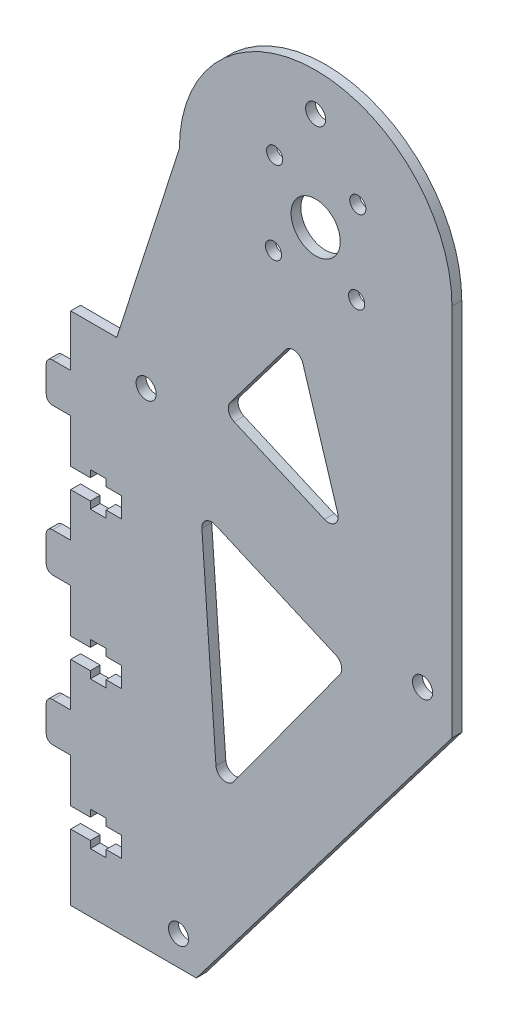
from build123d import *

# Parameters (mm, degrees)
SKETCH_1_R      = 5.0225
SKETCH_1_R_2    = 2.05
SKETCH_1_R_3    = 1.649999998
EXTRUDE_1_DEPTH = 2
FILLET_1_R      = 2
FILLET_2_R      = 1.3


with BuildPart() as part:
    # 草图1 → 凸台-拉伸1 (new body)
    with BuildSketch(Plane.XY):
        with BuildLine():
            Line((298.545628784, -83.894391363), (298.545628784, -92.841778663))
            Line((298.545628784, -92.841778663), (302.545628784, -92.841778663))
            Line((302.545628784, -92.841778663), (302.545628784, -91.391778663))
            Line((302.545628784, -91.391778663), (305.745628784, -91.391778663))
            Line((305.745628784, -91.391778663), (305.745628784, -92.841778663))
            Line((305.745628784, -92.841778663), (308.945628784, -92.841778663))
            Line((308.945628784, -92.841778663), (308.945628784, -96.941778663))
            Line((308.945628784, -96.941778663), (305.745628784, -96.941778663))
            Line((305.745628784, -96.941778663), (305.745628784, -98.391778663))
            Line((305.745628784, -98.391778663), (302.545628784, -98.391778663))
            Line((302.545628784, -98.391778663), (302.545628784, -96.941778663))
            Line((302.545628784, -96.941778663), (298.545628784, -96.941778663))
            Line((298.545628784, -96.941778663), (298.545628784, -105.894391358))
            Line((298.545628784, -105.894391358), (293.545628784, -105.894391358))
            Line((293.545628784, -105.894391358), (293.545628784, -113.894391358))
            Line((293.545628784, -113.894391358), (298.545628784, -113.894391358))
            Line((298.545628784, -113.894391358), (298.545628784, -122.847004054))
            Line((298.545628784, -122.847004054), (302.545628784, -122.847004054))
            Line((302.545628784, -122.847004054), (302.545628784, -121.397004054))
            Line((302.545628784, -121.397004054), (305.745628784, -121.397004054))
            Line((305.745628784, -121.397004054), (305.745628784, -122.847004054))
            Line((305.745628784, -122.847004054), (308.945628784, -122.847004054))
            Line((308.945628784, -122.847004054), (308.945628784, -126.947004054))
            Line((308.945628784, -126.947004054), (305.745628784, -126.947004054))
            Line((305.745628784, -126.947004054), (305.745628784, -128.397004054))
            Line((305.745628784, -128.397004054), (302.545628784, -128.397004054))
            Line((302.545628784, -128.397004054), (302.545628784, -126.947004054))
            Line((302.545628784, -126.947004054), (298.545628784, -126.947004054))
            Line((298.545628784, -126.947004054), (298.545628784, -140.447004054))
            Line((298.545628784, -140.447004054), (324.188862368, -140.447004054))
            Line((324.188862368, -140.447004054), (376.358604426, -71.946984141))
            Line((376.358604426, -71.946984141), (376.358604426, 4.396201153))
            ThreePointArc((376.358604426, 4.396201153), (348.536987634, 32.217817945), (320.715370843, 4.396201153))
            Line((320.715370843, 4.396201153), (307.936987634, -35.346984141))
            Line((307.936987634, -35.346984141), (298.545628784, -35.346984141))
            Line((298.545628784, -35.346984141), (298.545628784, -45.889165972))
            Line((298.545628784, -45.889165972), (293.545628784, -45.889165972))
            Line((293.545628784, -45.889165972), (293.545628784, -53.889165972))
            Line((293.545628784, -53.889165972), (298.545628784, -53.889165972))
            Line((298.545628784, -53.889165972), (298.545628784, -62.841778668))
            Line((298.545628784, -62.841778668), (302.545628784, -62.841778668))
            Line((302.545628784, -62.841778668), (302.545628784, -61.391778668))
            Line((302.545628784, -61.391778668), (305.745628784, -61.391778668))
            Line((305.745628784, -61.391778668), (305.745628784, -62.841778668))
            Line((305.745628784, -62.841778668), (308.945628784, -62.841778668))
            Line((308.945628784, -62.841778668), (308.945628784, -66.941778668))
            Line((308.945628784, -66.941778668), (305.745628784, -66.941778668))
            Line((305.745628784, -66.941778668), (305.745628784, -68.391778668))
            Line((305.745628784, -68.391778668), (302.545628784, -68.391778668))
            Line((302.545628784, -68.391778668), (302.545628784, -66.941778668))
            Line((302.545628784, -66.941778668), (298.545628784, -66.941778668))
            Line((298.545628784, -66.941778668), (298.545628784, -75.894391363))
            Line((298.545628784, -75.894391363), (293.545628784, -75.894391363))
            Line((293.545628784, -75.894391363), (293.545628784, -83.894391363))
            Line((293.545628784, -83.894391363), (298.545628784, -83.894391363))
        make_face()
        with Locations((348.536987634, 4.396201153)):
            Circle(SKETCH_1_R, mode=Mode.SUBTRACT)
        with Locations((348.537256281, 24.457337504)):
            Circle(SKETCH_1_R_2, mode=Mode.SUBTRACT)
        with Locations((320.545628784, -134.447004054)):
            Circle(SKETCH_1_R_2, mode=Mode.SUBTRACT)
        with Locations((370.358604426, -65.946984141)):
            Circle(SKETCH_1_R_2, mode=Mode.SUBTRACT)
        with Locations((313.936987634, -41.346984141)):
            Circle(SKETCH_1_R_2, mode=Mode.SUBTRACT)
        with Locations((340.172950793, 13.001018857)):
            Circle(SKETCH_1_R_3, mode=Mode.SUBTRACT)
        with Locations((357.141805339, 12.760237994)):
            Circle(SKETCH_1_R_3, mode=Mode.SUBTRACT)
        with Locations((356.901024475, -4.208616551)):
            Circle(SKETCH_1_R_3, mode=Mode.SUBTRACT)
        with Locations((339.93216993, -3.967835688)):
            Circle(SKETCH_1_R_3, mode=Mode.SUBTRACT)
        Polygon((354.947285032, -70.136765586), (328.579617375, -106.396108383), (325.08144343, -57.115165973), align=None, mode=Mode.SUBTRACT)
        Polygon((329.571126451, -37.254352656), (354.337315751, -48.052488042), (344.758747766, -17.175445836), align=None, mode=Mode.SUBTRACT)
    extrude(amount=EXTRUDE_1_DEPTH)

    # 圆角1
    fillet_1_edges = [part.edges().sort_by_distance(p)[0] for p in [
        (354.947285032, -70.136765586, 1),
        (325.08144343, -57.115165973, 1),
        (328.579617375, -106.396108383, 1),
        (344.758747766, -17.175445836, 1),
        (329.571126451, -37.254352656, 1),
        (354.337315751, -48.052488042, 1),
    ]]
    fillet(fillet_1_edges, radius=FILLET_1_R)

    # 圆角2
    fillet_2_edges = [part.edges().sort_by_distance(p)[0] for p in [
        (293.545628784, -113.894391358, 1),
        (293.545628784, -105.894391358, 1),
        (293.545628784, -83.894391363, 1),
        (293.545628784, -75.894391363, 1),
        (293.545628784, -53.889165972, 1),
        (293.545628784, -45.889165972, 1),
    ]]
    fillet(fillet_2_edges, radius=FILLET_2_R)


solid = part.part
